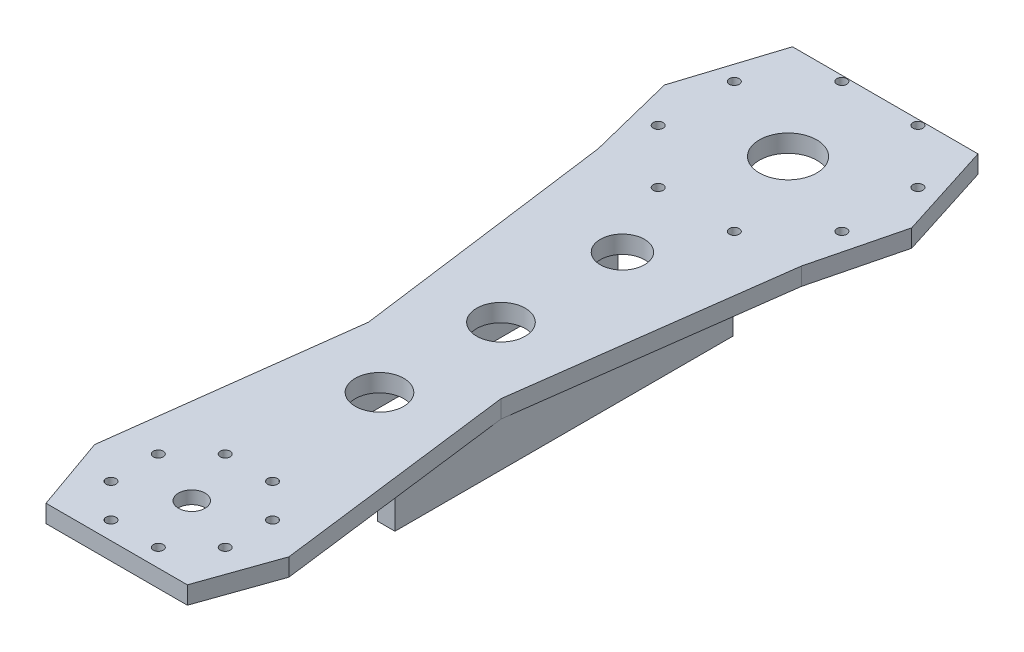
from build123d import *

# Parameters (mm, degrees)
SK_THIGH_PLATE_R         = 2.25
SK_THIGH_PLATE_R_2       = 6
SK_THIGH_PLATE_R_3       = 13
SK_THIGH_PLATE_R_4       = 11
SK_THIGH_PLATE_R_5       = 10
THIGH_PLATE_DEPTH        = 8
SK_PITCH_PILOT_RECESS_R  = 22.15
PITCH_PILOT_RECESS_DEPTH = 2.2
SK_FRONT_FLANGE_W        = 153
SK_FRONT_FLANGE_H        = 20
FRONT_FLANGE_DEPTH       = 8
SK_BACK_FLANGE_W         = 153
SK_BACK_FLANGE_H         = 20
BACK_FLANGE_DEPTH        = 8


with BuildPart() as part:
    # SK_Thigh_Plate → Thigh_Plate (new body)
    with BuildSketch(Plane(origin=(0, 30, 0), x_dir=(1, 0, 0), z_dir=(0, 1, 0))):
        Polygon((-32, -34), (32, -34), (44, 0), (30, 110), (46, 230), (56, 270), (42, 314), (-42, 314), (-56, 270), (-46, 230), (-30, 110), (-44, 0), align=None)
        with Locations(Location((25.86862691, 10.715136106, 0), (0, 0, 270))):
            Circle(SK_THIGH_PLATE_R, mode=Mode.SUBTRACT)
        with Locations(Location((10.715136106, 25.86862691, 0), (0, 0, 270))):
            Circle(SK_THIGH_PLATE_R, mode=Mode.SUBTRACT)
        with Locations(Location((-10.715136106, 25.86862691, 0), (0, 0, 270))):
            Circle(SK_THIGH_PLATE_R, mode=Mode.SUBTRACT)
        with Locations(Location((-25.86862691, 10.715136106, 0), (0, 0, 270))):
            Circle(SK_THIGH_PLATE_R, mode=Mode.SUBTRACT)
        with Locations(Location((-25.86862691, -10.715136106, 0), (0, 0, 270))):
            Circle(SK_THIGH_PLATE_R, mode=Mode.SUBTRACT)
        with Locations(Location((-10.715136106, -25.86862691, 0), (0, 0, 270))):
            Circle(SK_THIGH_PLATE_R, mode=Mode.SUBTRACT)
        with Locations(Location((10.715136106, -25.86862691, 0), (0, 0, 270))):
            Circle(SK_THIGH_PLATE_R, mode=Mode.SUBTRACT)
        with Locations(Location((25.86862691, -10.715136106, 0), (0, 0, 270))):
            Circle(SK_THIGH_PLATE_R, mode=Mode.SUBTRACT)
        with Locations(Location((41.574578963, 287.220754456, 0), (0, 0, 270))):
            Circle(SK_THIGH_PLATE_R, mode=Mode.SUBTRACT)
        with Locations(Location((17.220754456, 311.574578963, 0), (0, 0, 270))):
            Circle(SK_THIGH_PLATE_R, mode=Mode.SUBTRACT)
        with Locations(Location((-17.220754456, 311.574578963, 0), (0, 0, 270))):
            Circle(SK_THIGH_PLATE_R, mode=Mode.SUBTRACT)
        with Locations(Location((-41.574578963, 287.220754456, 0), (0, 0, 270))):
            Circle(SK_THIGH_PLATE_R, mode=Mode.SUBTRACT)
        with Locations(Location((-41.574578963, 252.779245544, 0), (0, 0, 270))):
            Circle(SK_THIGH_PLATE_R, mode=Mode.SUBTRACT)
        with Locations(Location((-17.220754456, 228.425421037, 0), (0, 0, 270))):
            Circle(SK_THIGH_PLATE_R, mode=Mode.SUBTRACT)
        with Locations(Location((17.220754456, 228.425421037, 0), (0, 0, 270))):
            Circle(SK_THIGH_PLATE_R, mode=Mode.SUBTRACT)
        with Locations(Location((41.574578963, 252.779245544, 0), (0, 0, 270))):
            Circle(SK_THIGH_PLATE_R, mode=Mode.SUBTRACT)
        with Locations(Location((0, 0, 0), (0, 0, 270))):
            Circle(SK_THIGH_PLATE_R_2, mode=Mode.SUBTRACT)
        with Locations(Location((0, 270, 0), (0, 0, 270))):
            Circle(SK_THIGH_PLATE_R_3, mode=Mode.SUBTRACT)
        with Locations(Location((0, 85, 0), (0, 0, 270))):
            Circle(SK_THIGH_PLATE_R_4, mode=Mode.SUBTRACT)
        with Locations(Location((0, 140, 0), (0, 0, 270))):
            Circle(SK_THIGH_PLATE_R_4, mode=Mode.SUBTRACT)
        with Locations(Location((0, 195, 0), (0, 0, 270))):
            Circle(SK_THIGH_PLATE_R_5, mode=Mode.SUBTRACT)
    extrude(amount=THIGH_PLATE_DEPTH)

    # SK_Pitch_Pilot_Recess → Pitch_Pilot_Recess (cut)
    with BuildSketch(Plane(origin=(0, 30, 0), x_dir=(1, 0, 0), z_dir=(0, 1, 0))):
        with Locations(Location((0, 0, 0), (0, 0, 270))):
            Circle(SK_PITCH_PILOT_RECESS_R)
    extrude(amount=PITCH_PILOT_RECESS_DEPTH, mode=Mode.SUBTRACT)

    # SK_Front_Flange → Front_Flange (add)
    with BuildSketch(Plane(origin=(22, 0, 0), x_dir=(0, 0, -1), z_dir=(1, 0, 0))):
        with Locations((138.5, 20)):
            Rectangle(SK_FRONT_FLANGE_W, SK_FRONT_FLANGE_H)
    extrude(amount=FRONT_FLANGE_DEPTH)

    # SK_Back_Flange → Back_Flange (add)
    with BuildSketch(Plane(origin=(-30, 0, 0), x_dir=(0, 0, -1), z_dir=(1, 0, 0))):
        with Locations((138.5, 20)):
            Rectangle(SK_BACK_FLANGE_W, SK_BACK_FLANGE_H)
    extrude(amount=BACK_FLANGE_DEPTH)


solid = part.part
